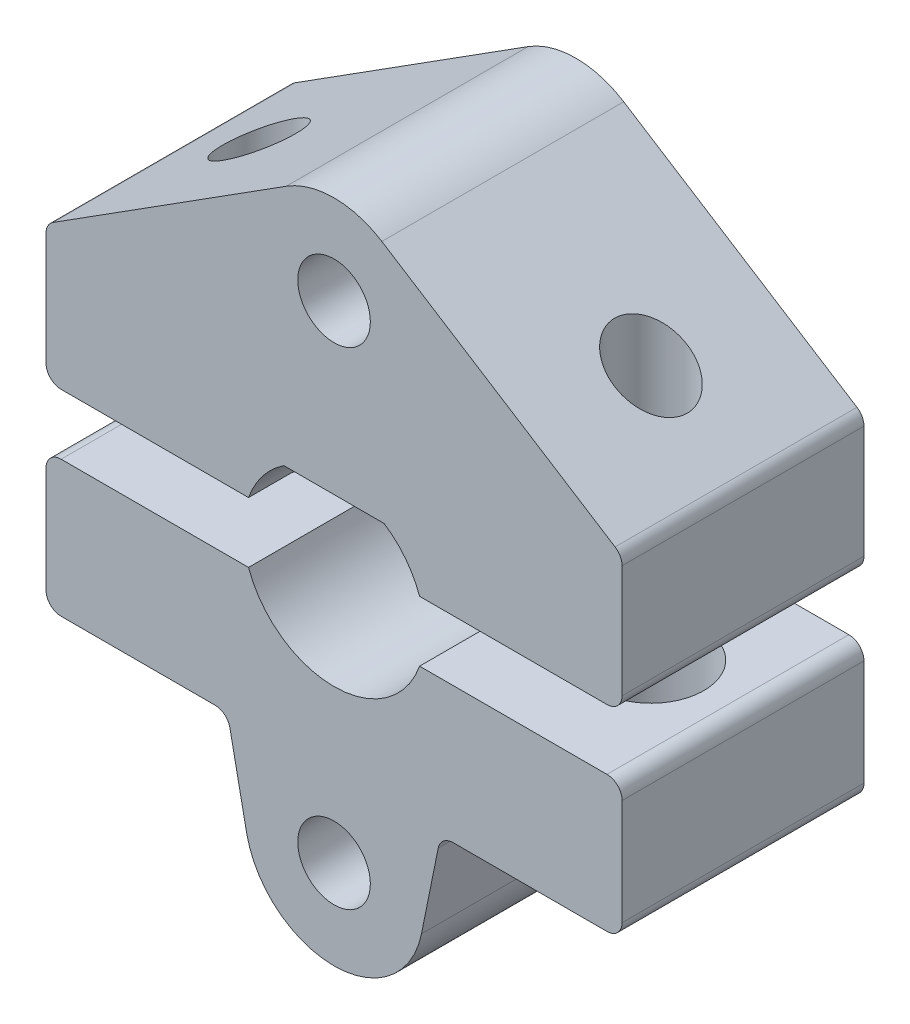
from build123d import *

# Parameters (mm, degrees)
SKETCH_1_R          = 1.2
EXTRUDE_1_DEPTH     = 8
EXTRUDE_1_2_DEPTH   = 8
SKETCH_2_R          = 1.2
CUT_EXTRUDE_1_DEPTH = 21.66397832
SKETCH_3_R          = 1.75
CUT_EXTRUDE_2_DEPTH = 4.5


with BuildPart() as part:
    # 草图1 → 凸台-拉伸1 (new body)
    with BuildSketch(Plane.XY):
        with BuildLine():
            Line((-1.658312395, 2.5), (1.658312395, 2.5))
            ThreePointArc((1.658312395, 2.5), (2.365419176, 1.84520788), (2.828427125, 1))
            Line((2.828427125, 1), (9.026279442, 1))
            ThreePointArc((9.026279442, 1), (9.379832832, 1.146446609), (9.526279442, 1.5))
            Line((9.526279442, 1.5), (9.526279442, 5.22507425))
            ThreePointArc((9.526279442, 5.22507425), (9.464414867, 5.465983671), (9.294130046, 5.647278056))
            Line((9.294130046, 5.647278056), (1.580318565, 10.541002455))
            ThreePointArc((1.580318565, 10.541002455), (0, 11), (-1.580318565, 10.541002455))
            Line((-1.580318565, 10.541002455), (-9.294130046, 5.647278056))
            ThreePointArc((-9.294130046, 5.647278056), (-9.464414867, 5.465983671), (-9.526279442, 5.22507425))
            Line((-9.526279442, 5.22507425), (-9.526279442, 1.5))
            ThreePointArc((-9.526279442, 1.5), (-9.379832832, 1.146446609), (-9.026279442, 1))
            Line((-9.026279442, 1), (-2.828427125, 1))
            ThreePointArc((-2.828427125, 1), (-2.365419176, 1.84520788), (-1.658312395, 2.5))
        make_face()
        with Locations((0, 8.05)):
            Circle(SKETCH_1_R, mode=Mode.SUBTRACT)
    extrude(amount=EXTRUDE_1_DEPTH)


with BuildPart() as body_2:
    # 草图1 → Extrude 1 2 (new body)
    with BuildSketch(Plane.XY):
        with BuildLine():
            Line((-9.026279442, -1), (-2.828427125, -1))
            ThreePointArc((-2.828427125, -1), (0, -3), (2.828427125, -1))
            Line((2.828427125, -1), (9.026279442, -1))
            ThreePointArc((9.026279442, -1), (9.379832832, -1.146446609), (9.526279442, -1.5))
            Line((9.526279442, -1.5), (9.526279442, -5))
            ThreePointArc((9.526279442, -5), (9.379832832, -5.353553391), (9.026279442, -5.5))
            Line((9.026279442, -5.5), (3.935174447, -5.5))
            ThreePointArc((3.935174447, -5.5), (3.6186464, -5.612947037), (3.445121974, -5.900760016))
            Line((3.445121974, -5.900760016), (2.891309587, -8.635515904))
            ThreePointArc((2.891309587, -8.635515904), (0, -11), (-2.891309587, -8.635515904))
            Line((-2.891309587, -8.635515904), (-3.445121974, -5.900760016))
            ThreePointArc((-3.445121974, -5.900760016), (-3.6186464, -5.612947037), (-3.935174447, -5.5))
            Line((-3.935174447, -5.5), (-9.026279442, -5.5))
            ThreePointArc((-9.026279442, -5.5), (-9.379832832, -5.353553391), (-9.526279442, -5))
            Line((-9.526279442, -5), (-9.526279442, -1.5))
            ThreePointArc((-9.526279442, -1.5), (-9.379832832, -1.146446609), (-9.026279442, -1))
        make_face()
        with Locations((0, -8.05)):
            Circle(SKETCH_1_R, mode=Mode.SUBTRACT)
    extrude(amount=EXTRUDE_1_2_DEPTH)


with BuildPart() as cut_extrude_1_tool:
    # 草图2 → 切除-拉伸1 (new, through all)
    with BuildSketch(Plane.XZ.offset(5.5)):
        with Locations(Location((6.480726944, 4, 0), (0, 0, 270))):
            Circle(SKETCH_2_R)
        with Locations(Location((-6.480726944, 4, 0), (0, 0, 270))):
            Circle(SKETCH_2_R)
    extrude(amount=-CUT_EXTRUDE_1_DEPTH)


with BuildPart() as part_1:
    add(part.part)

    # 切除-拉伸1: cut by cut_extrude_1_tool
    add(cut_extrude_1_tool.part, mode=Mode.SUBTRACT)


with BuildPart() as body_2_1:
    add(body_2.part)

    # 切除-拉伸1: cut by cut_extrude_1_tool
    add(cut_extrude_1_tool.part, mode=Mode.SUBTRACT)

    # 草图3 → 切除-拉伸2 (cut)
    with BuildSketch(Plane.XZ.offset(5.5)):
        with Locations(Location((-6.480726944, 4, 0), (0, 0, 270))):
            Circle(SKETCH_3_R)
        with Locations(Location((6.480726944, 4, 0), (0, 0, 270))):
            Circle(SKETCH_3_R)
    extrude(amount=-CUT_EXTRUDE_2_DEPTH, mode=Mode.SUBTRACT)


solid = Compound([part_1.part, body_2_1.part])
